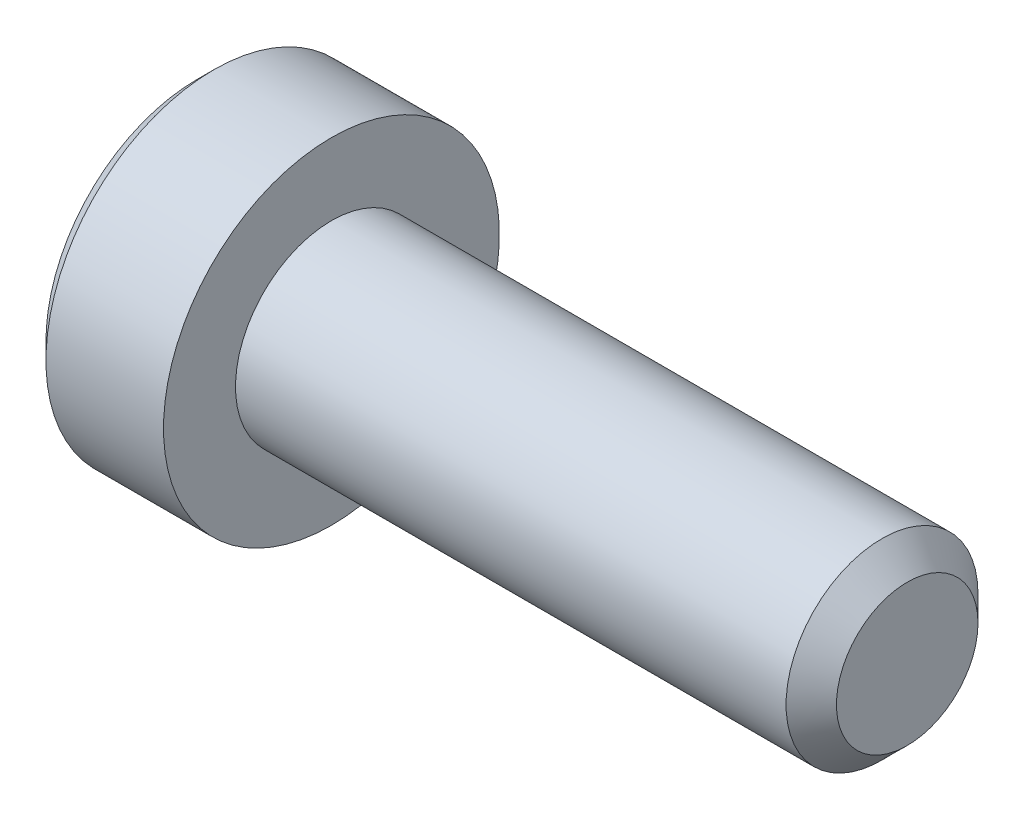
from build123d import *

# Parameters (mm, degrees)
SKETCH2_R           = 2
BOSS_EXTRUDE1_DEPTH = 12
CHAMFER1_SIZE       = 0.525
CUT_EXTRUDE1_DEPTH  = 2.42


with BuildPart() as part:
    # Sketch2 → Boss-Extrude1 (new body)
    with BuildSketch(Plane(origin=(6, 0, 0), x_dir=(0, 0, -1), z_dir=(1, 0, 0))):
        Circle(SKETCH2_R)
    extrude(amount=-BOSS_EXTRUDE1_DEPTH)

    # Chamfer1
    chamfer1_edges = [part.edges().sort_by_distance(p)[0] for p in [
        (6, 0, 2),
    ]]
    chamfer(chamfer1_edges, length=CHAMFER1_SIZE)

    # Sketch6 → Revolve1 (revolve)
    with BuildSketch(Plane.XY):
        Polygon((-8.45, 3.5), (-8.8, 3.15), (-8.8, 0), (-6, 0), (-6, 3.5), align=None)
    revolve(axis=Axis((-6, 0, 0), (-1, 0, 0)))

    # Sketch4 → Cut-Extrude1 (cut)
    with BuildSketch(Plane(origin=(-8.8, 0, 0), x_dir=(0, 0, -1), z_dir=(1, 0, 0))):
        Polygon((0, 1.443375673), (-1.25, 0.721687836), (-1.25, -0.721687836), (0, -1.443375673), (1.25, -0.721687836), (1.25, 0.721687836), align=None)
    extrude(amount=CUT_EXTRUDE1_DEPTH, mode=Mode.SUBTRACT)

    # Cut-Extrude2 cone 1 section (through the dimple's axis) → Cut-Extrude2 (revolve, cut)
    with BuildSketch(Plane(origin=(-8.8, 0, 0), x_dir=(0, 0, 1), z_dir=(0, 1, 0))):
        Polygon((0, 0), (1.443375673, 0), (0, 1.443375673), align=None)
    revolve(axis=Axis((-8.8, 0, 0), (1, 0, 0)), mode=Mode.SUBTRACT)


solid = part.part
